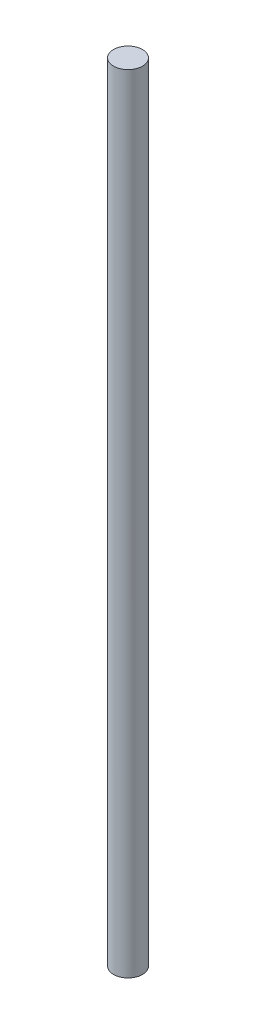
from build123d import *


with BuildPart() as part:
    # Sketch3 → Revolve2 (revolve)
    with BuildSketch(Plane.XY, mode=Mode.PRIVATE) as revolve2_sk:
        Polygon((0, 50.8), (-0.9271, 50.8), (-0.9271, 0.384017394), (0, 0), align=None)
    revolve(revolve2_sk.sketch.rotate(Axis((0, 0, 0), (0, 1, 0)), 270), axis=Axis((0, 0, 0), (0, 1, 0)))


solid = part.part
